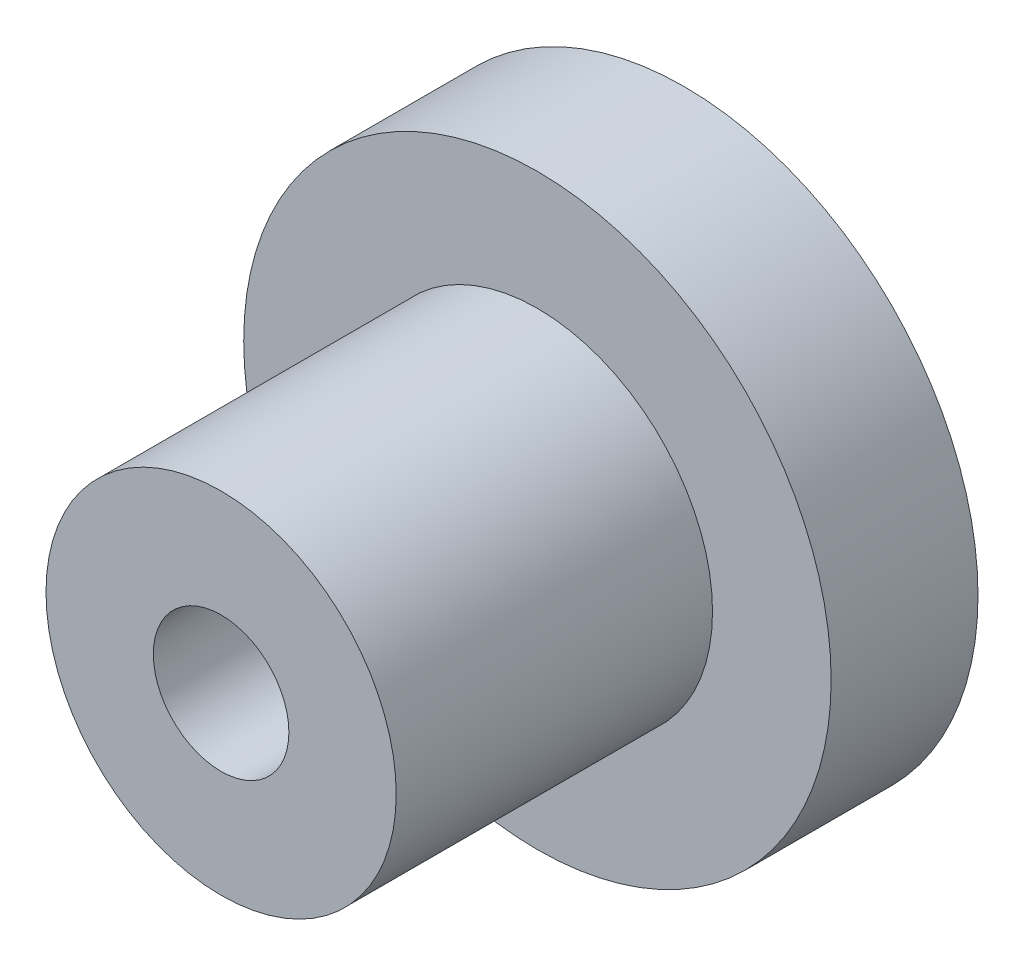
from build123d import *
from build123d.topology import SkipClean

# Parameters (mm, degrees)
SKETCH1_R           = 3.875
SKETCH1_R_2         = 1.5
BOSS_EXTRUDE1_DEPTH = 7
BOSS_EXTRUDE2_START = 3.25
SKETCH2_R           = 6.5
SKETCH2_R_2         = 1.5
BOSS_EXTRUDE2_DEPTH = 3.25


with BuildPart() as part:
    # Sketch1 → Boss-Extrude1 (new body)
    with BuildSketch(Plane.XY):
        Circle(SKETCH1_R)
        Circle(SKETCH1_R_2, mode=Mode.SUBTRACT)
    extrude(amount=BOSS_EXTRUDE1_DEPTH)

    # Sketch2 → Boss-Extrude2 (add)
    with SkipClean():  # the faces are left unmerged after this step: merging them gives an invalid solid
        with BuildSketch(Plane(origin=(0, 0, 0), x_dir=(-1, 0, 0), z_dir=(0, 0, -1)).offset(BOSS_EXTRUDE2_START)):
            with Locations(Location((0, 0, 0), (0, 0, 180))):
                Circle(SKETCH2_R)
            Circle(SKETCH2_R_2, mode=Mode.SUBTRACT)
        extrude(amount=-BOSS_EXTRUDE2_DEPTH)


solid = part.part
